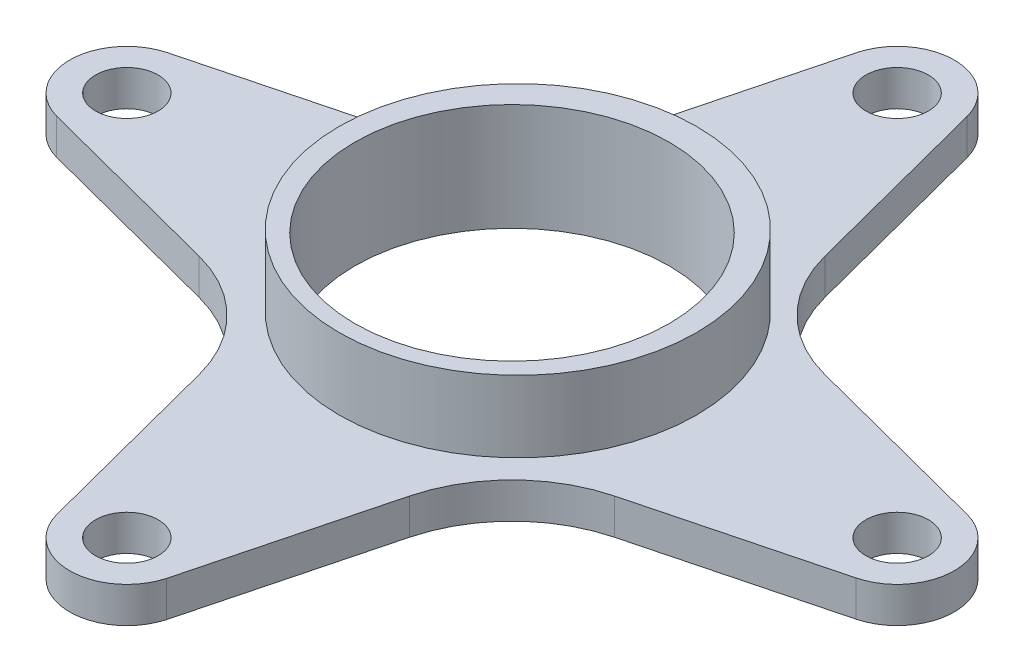
from build123d import *

# Parameters (mm, degrees)
SKETCH1_R           = 5.55625
SKETCH1_R_2         = 31.75
SKETCH1_R_3         = 27.94
BOSS_EXTRUDE1_DEPTH = 6.35
SKETCH2_R           = 31.75
SKETCH2_R_2         = 27.94
BOSS_EXTRUDE2_DEPTH = 12.7


with BuildPart() as part:
    # Sketch1 → Boss-Extrude1 (new body)
    # profile 1 of 6: a face of its own
    with BuildSketch(Plane(origin=(0, 0, 0), x_dir=(1, 0, 0), z_dir=(0, 1, 0))):
        with BuildLine():
            ThreePointArc((-58.292365076, 0), (-62.236852489, 8.036977248), (-71.007523203, 9.833451426))
            ThreePointArc((-71.007523203, 9.833451426), (-78.611836011, 0.103683747), (-71.207683119, -9.7792547))
            Line((-71.207683119, -9.7792547), (-70.807129229, -9.883353974))
            ThreePointArc((-70.807129229, -9.883353974), (-62.155492987, -7.973393374), (-58.292365076, 0))
        make_face()
        with Locations(Location((-68.452365076, 0, 0), (0, 0, 270))):
            Circle(SKETCH1_R, mode=Mode.SUBTRACT)
    # profile 2 of 6: a face of its own
    with BuildSketch(Plane(origin=(0, 0, 0), x_dir=(1, 0, 0), z_dir=(0, 1, 0))):
        with BuildLine():
            Line((-9.883353974, 70.807129229), (-18.697333242, 36.892640474))
            ThreePointArc((-18.697333242, 36.892640474), (-25.320558446, 25.320679007), (-36.892798129, 18.697939919))
            Line((-36.892798129, 18.697939919), (-71.007523203, 9.833451426))
            ThreePointArc((-71.007523203, 9.833451426), (-62.236852489, 8.036977248), (-58.292365076, 0))
            ThreePointArc((-58.292365076, 0), (-62.155492987, -7.973393374), (-70.807129229, -9.883353974))
            Line((-70.807129229, -9.883353974), (-36.892640474, -18.697333242))
            ThreePointArc((-36.892640474, -18.697333242), (-25.320679007, -25.320558446), (-18.697939919, -36.892798129))
            Line((-18.697939919, -36.892798129), (-9.833451426, -71.007523203))
            ThreePointArc((-9.833451426, -71.007523203), (-1.287970014, -58.374332865), (10.16, -68.452365076))
            ThreePointArc((10.16, -68.452365076), (10.090601478, -69.637844646), (9.883353974, -70.807129229))
            Line((9.883353974, -70.807129229), (18.697333242, -36.892640474))
            ThreePointArc((18.697333242, -36.892640474), (25.320558446, -25.320679007), (36.892798129, -18.697939919))
            Line((36.892798129, -18.697939919), (71.007523203, -9.833451426))
            ThreePointArc((71.007523203, -9.833451426), (58.292889794, -0.103256972), (70.807129229, 9.883353974))
            Line((70.807129229, 9.883353974), (36.892640474, 18.697333242))
            ThreePointArc((36.892640474, 18.697333242), (25.320679007, 25.320558446), (18.697939919, 36.892798129))
            Line((18.697939919, 36.892798129), (9.833451426, 71.007523203))
            ThreePointArc((9.833451426, 71.007523203), (10.078032211, 69.74033509), (10.16, 68.452365076))
            ThreePointArc((10.16, 68.452365076), (-1.18547957, 58.361763598), (-9.883353974, 70.807129229))
        make_face()
        Circle(SKETCH1_R_2, mode=Mode.SUBTRACT)
    # profile 3 of 6: a face of its own
    with BuildSketch(Plane(origin=(0, 0, 0), x_dir=(1, 0, 0), z_dir=(0, 1, 0))):
        with BuildLine():
            ThreePointArc((10.16, -68.452365076), (-1.287970014, -58.374332865), (-9.833451426, -71.007523203))
            ThreePointArc((-9.833451426, -71.007523203), (-0.103683747, -78.611836011), (9.7792547, -71.207683119))
            Line((9.7792547, -71.207683119), (9.883353974, -70.807129229))
            ThreePointArc((9.883353974, -70.807129229), (10.090601478, -69.637844646), (10.16, -68.452365076))
        make_face()
        with Locations(Location((0, -68.452365076, 0), (0, 0, 270))):
            Circle(SKETCH1_R, mode=Mode.SUBTRACT)
    # profile 4 of 6: a face of its own
    with BuildSketch(Plane(origin=(0, 0, 0), x_dir=(1, 0, 0), z_dir=(0, 1, 0))):
        with BuildLine():
            Line((-9.7792547, 71.207683119), (-9.883353974, 70.807129229))
            ThreePointArc((-9.883353974, 70.807129229), (-1.18547957, 58.361763598), (10.16, 68.452365076))
            ThreePointArc((10.16, 68.452365076), (10.078032211, 69.74033509), (9.833451426, 71.007523203))
            ThreePointArc((9.833451426, 71.007523203), (0.103683747, 78.611836011), (-9.7792547, 71.207683119))
        make_face()
        with Locations(Location((0, 68.452365076, 0), (0, 0, 270))):
            Circle(SKETCH1_R, mode=Mode.SUBTRACT)
    # profile 5 of 6: a face of its own
    with BuildSketch(Plane(origin=(0, 0, 0), x_dir=(1, 0, 0), z_dir=(0, 1, 0))):
        with BuildLine():
            Line((71.207683119, 9.7792547), (70.807129229, 9.883353974))
            ThreePointArc((70.807129229, 9.883353974), (58.292889794, -0.103256972), (71.007523203, -9.833451426))
            ThreePointArc((71.007523203, -9.833451426), (76.489342324, -6.215512587), (78.612365076, 0))
            ThreePointArc((78.612365076, 0), (76.552353697, 6.133170823), (71.207683119, 9.7792547))
        make_face()
        with Locations(Location((68.452365076, 0, 0), (0, 0, 270))):
            Circle(SKETCH1_R, mode=Mode.SUBTRACT)
    # profile 6 of 6: a face of its own
    with BuildSketch(Plane(origin=(0, 0, 0), x_dir=(1, 0, 0), z_dir=(0, 1, 0))):
        Circle(SKETCH1_R_2)
        with Locations(Location((0, 0, 0), (0, 0, 270))):
            Circle(SKETCH1_R_3, mode=Mode.SUBTRACT)
    extrude(amount=BOSS_EXTRUDE1_DEPTH)

    # Sketch2 → Boss-Extrude2 (add)
    with BuildSketch(Plane(origin=(0, 6.35, 0), x_dir=(1, 0, 0), z_dir=(0, 1, 0))):
        with Locations(Location((0, 1.038430884, 0), (0, 0, 270))):
            Circle(SKETCH2_R)
        with Locations(Location((0, 0, 0), (0, 0, 270))):
            Circle(SKETCH2_R_2, mode=Mode.SUBTRACT)
    extrude(amount=BOSS_EXTRUDE2_DEPTH)


solid = part.part
